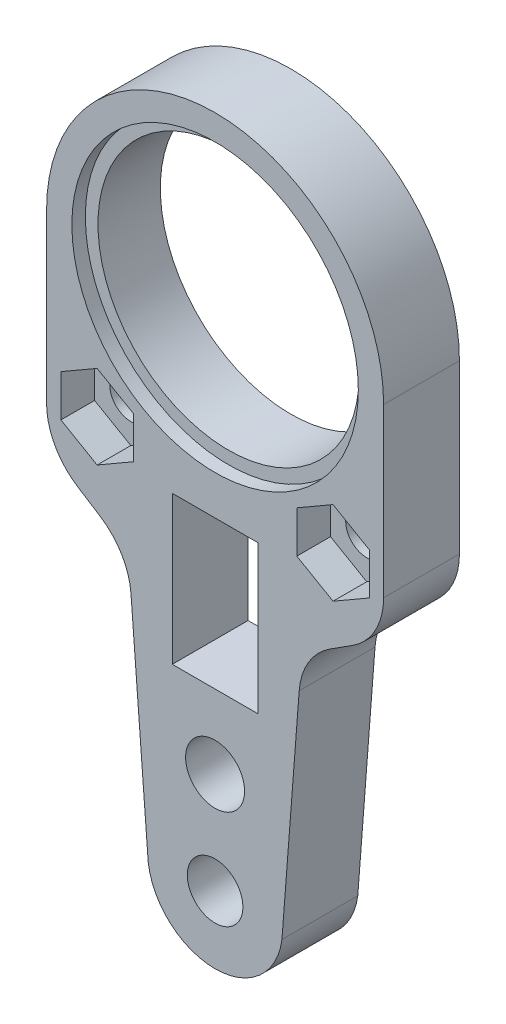
from build123d import *

# Parameters (mm, degrees)
SKETCH_1_R          = 7.75
SKETCH_1_R_2        = 1.25
SKETCH_1_R_3        = 1.65
SKETCH_1_R_4        = 1.75
SKETCH_1_W          = 5.081480492
SKETCH_1_H          = 8.790007362
EXTRUDE_1_DEPTH     = 4.5
SKETCH_2_R          = 8.5
CUT_EXTRUDE_1_DEPTH = 0.8
FILLET_1_R          = 4
CUT_EXTRUDE_2_DEPTH = 2


with BuildPart() as part:
    # 草图1 → 凸台-拉伸1 (new body)
    with BuildSketch(Plane.XY):
        with BuildLine():
            Line((-10, 0), (-10, -12.123829059))
            Line((-10, -12.123829059), (-5.144235045, -15.224714909))
            Line((-5.144235045, -15.224714909), (-3.96721445, -30.511086595))
            ThreePointArc((-3.96721445, -30.511086595), (0, -34), (3.96721445, -30.511086595))
            Line((3.96721445, -30.511086595), (5.144235045, -15.224714909))
            Line((5.144235045, -15.224714909), (10, -12.123829059))
            Line((10, -12.123829059), (10, 0))
            ThreePointArc((10, 0), (0, 10), (-10, 0))
        make_face()
        Circle(SKETCH_1_R, mode=Mode.SUBTRACT)
        with Locations((-7, -9.124143795)):
            Circle(SKETCH_1_R_2, mode=Mode.SUBTRACT)
        with Locations((7, -9.124143795)):
            Circle(SKETCH_1_R_2, mode=Mode.SUBTRACT)
        with Locations((0, -30)):
            Circle(SKETCH_1_R_3, mode=Mode.SUBTRACT)
        with Locations((0, -24)):
            Circle(SKETCH_1_R_4, mode=Mode.SUBTRACT)
        with Locations((0, -15.224714909)):
            Rectangle(SKETCH_1_W, SKETCH_1_H, mode=Mode.SUBTRACT)
    extrude(amount=EXTRUDE_1_DEPTH)

    # 草图2 → 切除-拉伸1 (cut)
    with BuildSketch(Plane.XY.offset(4.5)):
        Circle(SKETCH_2_R)
    extrude(amount=-CUT_EXTRUDE_1_DEPTH, mode=Mode.SUBTRACT)

    # 圆角1
    fillet_1_edges = [part.edges().sort_by_distance(p)[0] for p in [
        (-5.144235045, -15.224714909, 2.25),
        (-10, -12.123829059, 2.25),
        (10, -12.123829059, 2.25),
        (5.144235045, -15.224714909, 2.25),
    ]]
    fillet(fillet_1_edges, radius=FILLET_1_R)

    # 草图3 → 切除-拉伸2 (cut)
    with BuildSketch(Plane.XY.offset(4.5)):
        Polygon((7, -6.641537638), (9.15, -7.882840717), (9.15, -10.365446874), (7, -11.606749953), (4.85, -10.365446874), (4.85, -7.882840717), align=None)
        Polygon((-7, -6.641537638), (-4.85, -7.882840717), (-4.85, -10.365446874), (-7, -11.606749953), (-9.15, -10.365446874), (-9.15, -7.882840717), align=None)
    extrude(amount=-CUT_EXTRUDE_2_DEPTH, mode=Mode.SUBTRACT)


solid = part.part
